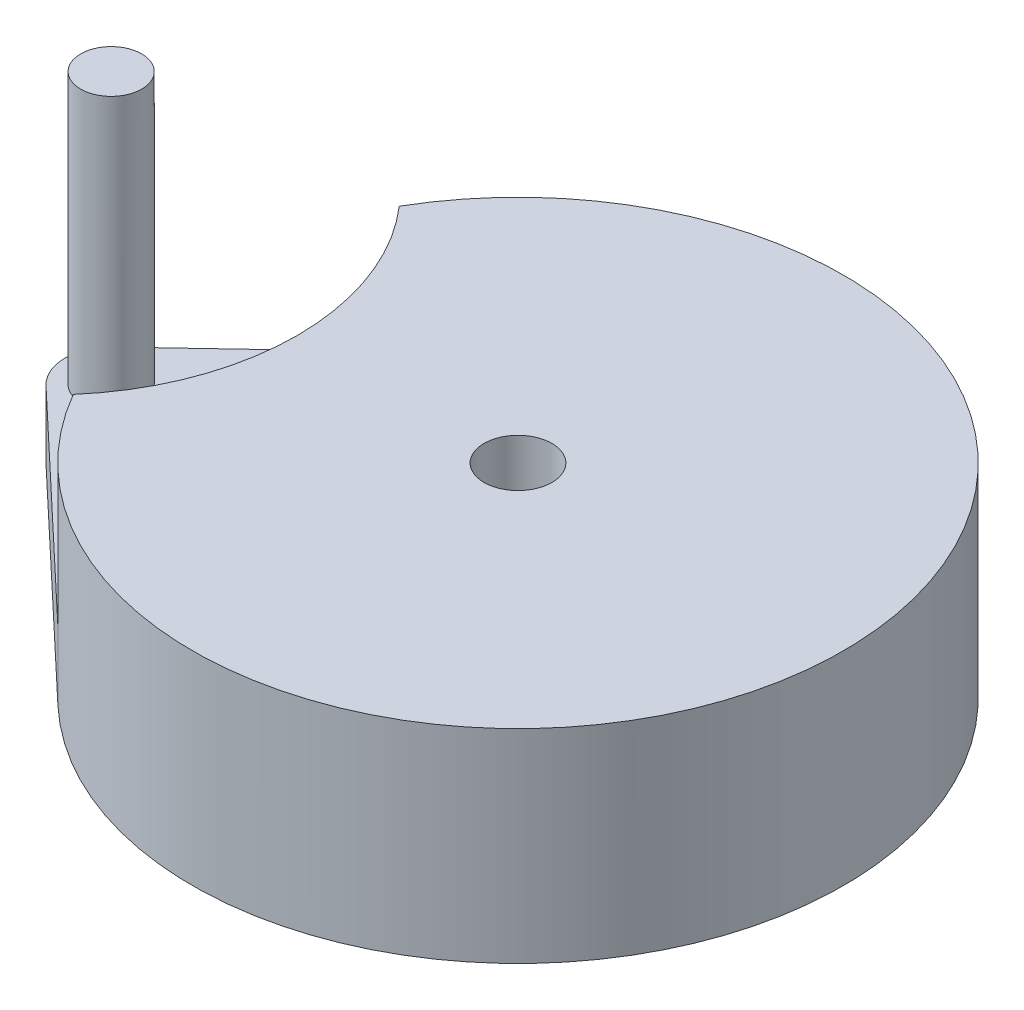
from build123d import *

# Parameters (mm, degrees)
SKETCH_2_R      = 2.5
EXTRUDE_1_DEPTH = 5
SKETCH_5_R      = 2.25
SKETCH_5_R_2    = 2.5
EXTRUDE_4_DEPTH = 10
SKETCH_6_R      = 2.25
EXTRUDE_5_DEPTH = 10


with BuildPart() as part:
    # 草圖2 → 填料-伸長1 (new body)
    with BuildSketch(Plane(origin=(0, 0, 0), x_dir=(1, 0, 0), z_dir=(0, 1, 0))):
        with BuildLine():
            Line((-32.334666667, 2.471706203), (-16.48, 17.447337906))
            ThreePointArc((-16.48, 17.447337906), (24, 0), (-16.48, -17.447337906))
            Line((-16.48, -17.447337906), (-32.334666667, -2.471706203))
            ThreePointArc((-32.334666667, -2.471706203), (-33.4, 0), (-32.334666667, 2.471706203))
        make_face()
        with Locations(Location((0, 0, 0), (0, 0, 270))):
            Circle(SKETCH_2_R, mode=Mode.SUBTRACT)
    extrude(amount=EXTRUDE_1_DEPTH)

    # 草圖5 → 填料-伸長4 (add)
    # profile 1 of 2: a face of its own
    with BuildSketch(Plane(origin=(0, 5, 0), x_dir=(1, 0, 0), z_dir=(0, 1, 0))):
        with Locations(Location((-30, 0, 0), (0, 0, 90))):
            Circle(SKETCH_5_R)
    # profile 2 of 2: a face of its own
    with BuildSketch(Plane(origin=(0, 5, 0), x_dir=(1, 0, 0), z_dir=(0, 1, 0))):
        with BuildLine():
            ThreePointArc((-20.773318517, -12.019535673), (24, 0), (-20.773318517, 12.019535673))
            ThreePointArc((-20.773318517, 12.019535673), (-16.277495404, 0), (-20.773318517, -12.019535673))
        make_face()
        with Locations(Location((0, 0, 0), (0, 0, 270))):
            Circle(SKETCH_5_R_2, mode=Mode.SUBTRACT)
    extrude(amount=EXTRUDE_4_DEPTH)

    # 草圖6 → 填料-伸長5 (add)
    with BuildSketch(Plane(origin=(0, 15, 0), x_dir=(1, 0, 0), z_dir=(0, 1, 0))):
        with Locations(Location((-30, 0, 0), (0, 0, 90))):
            Circle(SKETCH_6_R)
    extrude(amount=EXTRUDE_5_DEPTH)


solid = part.part
